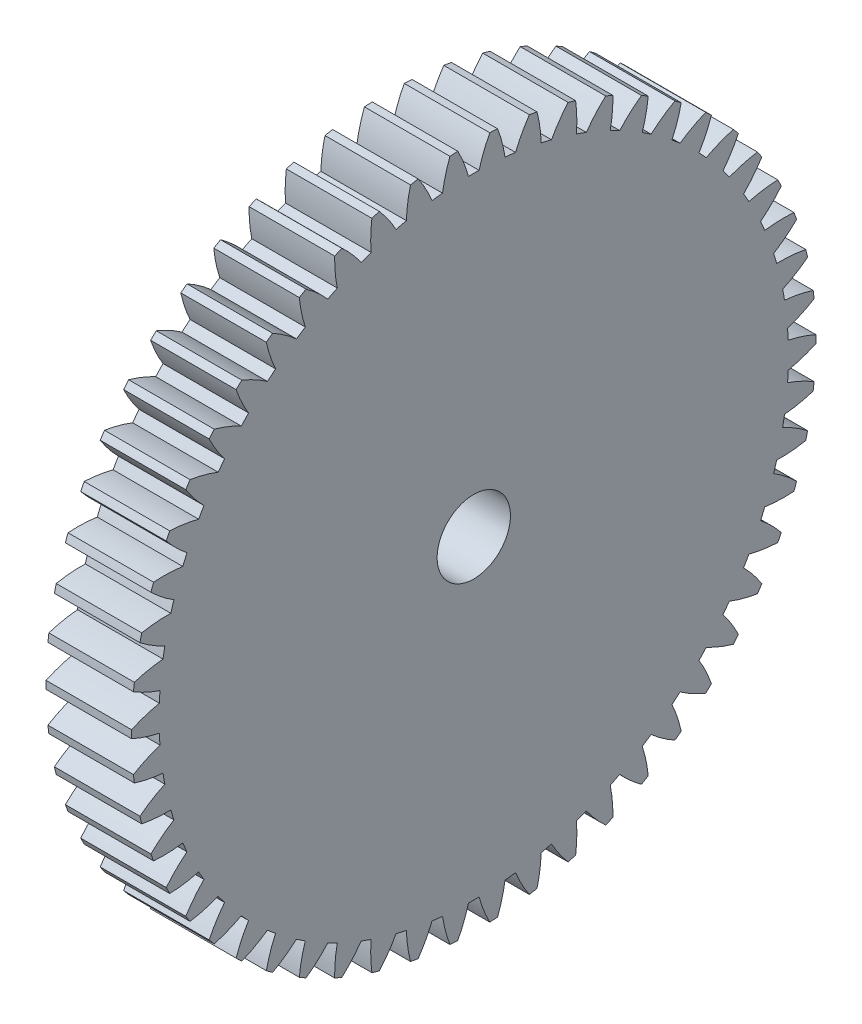
from build123d import *

# Parameters (mm, degrees)
BASPROSKE_W                  = 7
BASPROSKE_H                  = 28
TOOTHCUT_DEPTH               = 41.211938526
TEETHCUTS_COUNT              = 54
TEETHCUTS_ANGLE              = 353.333333333
HUBNEAONESKE_R               = 6
HUBNEARONE_DEPTH             = 7
BORSKE_R                     = 3
BORE_DEPTH                   = 12.0000508
R_P_TITION_CIRCULAIRE1_COUNT = 2
R_P_TITION_CIRCULAIRE1_ANGLE = 90


with BuildPart() as part:
    # BasProSke → Base-Revolve (revolve)
    with BuildSketch(Plane(origin=(0, 0, 0), x_dir=(1, 0, 0), z_dir=(0, 1, 0)), mode=Mode.PRIVATE) as base_revolve_sk:
        with Locations((3.5, 14)):
            Rectangle(BASPROSKE_W, BASPROSKE_H)
    revolve(base_revolve_sk.sketch.rotate(Axis((-10, 0, 0), (1, 0, 0)), 180), axis=Axis((-10, 0, 0), (1, 0, 0)))

    # TooCutSke → ToothCut (cut, through all)
    with BuildSketch(Plane(origin=(0, 0, 0), x_dir=(0, 0, -1), z_dir=(1, 0, 0))):
        with BuildLine():
            ThreePointArc((0.434342569, 25.745336423), (0, 25.749), (-0.434342569, 25.745336423))
            ThreePointArc((-0.434342569, 25.745336423), (-0.815032242, 26.894686589), (-1.321977338, 27.994203348))
            ThreePointArc((-1.321977338, 27.994203348), (0, 28.0254), (1.321977338, 27.994203348))
            ThreePointArc((1.321977338, 27.994203348), (0.815032242, 26.894686589), (0.434342569, 25.745336423))
        make_face()
    toothcut = extrude(amount=TOOTHCUT_DEPTH, mode=Mode.SUBTRACT)

    # TeethCuts: ToothCut ×54 about axis
    teethcuts_axis = Axis((-10, 0, 0), (1, 0, 0))
    for i in range(1, TEETHCUTS_COUNT):
        add(toothcut.rotate(teethcuts_axis, i * TEETHCUTS_ANGLE / (TEETHCUTS_COUNT - 1)), mode=Mode.SUBTRACT)

    # HubNeaOneSke → HubNearOne (add)
    with BuildSketch(Plane.ZY):
        with Locations(Location((0, 0, 0), (0, 0, 180))):
            Circle(HUBNEAONESKE_R)
    extrude(amount=HUBNEARONE_DEPTH)

    # BorSke → Bore (cut, symmetric)
    with BuildSketch(Plane(origin=(0, 0, 0), x_dir=(0, 0, -1), z_dir=(1, 0, 0))):
        with Locations(Location((0, 0, 0), (0, 0, 180))):
            Circle(BORSKE_R)
    extrude(amount=BORE_DEPTH, both=True, mode=Mode.SUBTRACT)

    # Esquisse1 → Trou pour taraudage pour trou taraudé M3x0.51 (revolve, cut)
    with BuildSketch(Plane(origin=(-3.5, -1.357245425, -5.844474729), x_dir=(0, 0.9740791214796851, -0.2262075708223862), z_dir=(1, 0, 0))):
        Polygon((0, 0), (0, 5.751075774), (1.25, 5), (1.25, 0), align=None)
    trou_pour_taraudage_pour_trou_taraud_m3 = revolve(axis=Axis((-3.5, -2.7936635, -12.02987715), (0, 0.22620757082238618, 0.9740791214796851)), mode=Mode.SUBTRACT)

    # Répétition circulaire1: Trou pour taraudage pour trou taraudé M3x0.51 ×2 about axis
    r_p_tition_circulaire1_axis = Axis((12.0000508, 0, 0), (-1, 0, 0))
    for i in range(1, R_P_TITION_CIRCULAIRE1_COUNT):
        add(trou_pour_taraudage_pour_trou_taraud_m3.rotate(r_p_tition_circulaire1_axis, i * R_P_TITION_CIRCULAIRE1_ANGLE / (R_P_TITION_CIRCULAIRE1_COUNT - 1)), mode=Mode.SUBTRACT)


solid = part.part
